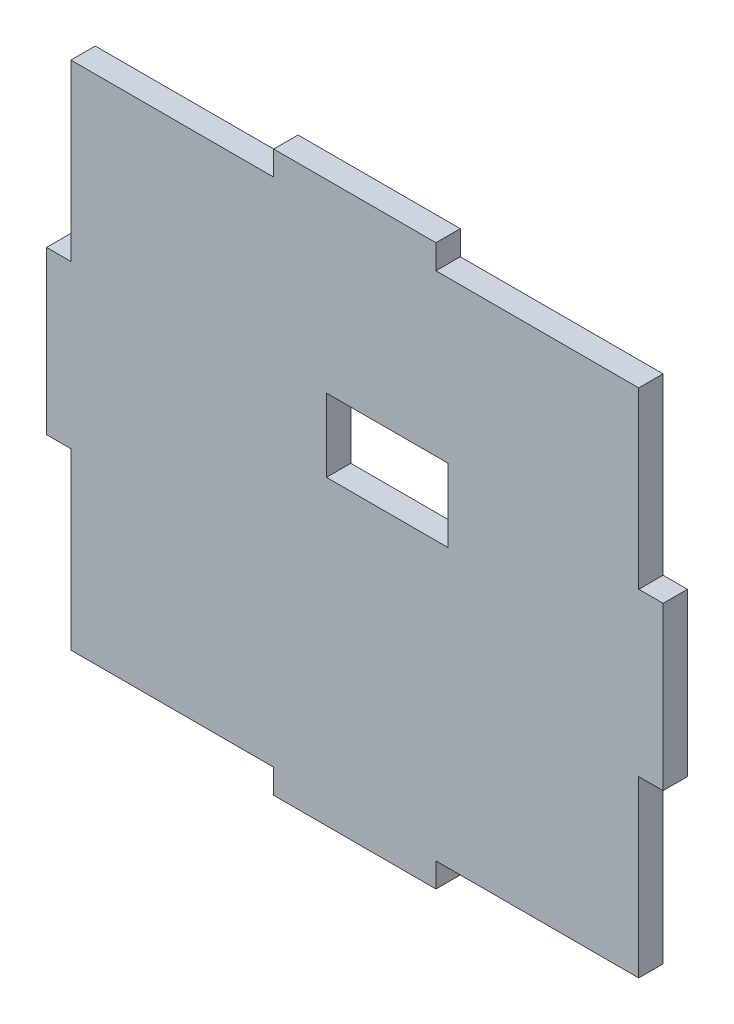
from build123d import *

# Parameters (mm, degrees)
SKETCH1_W           = 70
SKETCH1_H           = 63
BOSS_EXTRUDE1_DEPTH = 3
SKETCH2_W           = 15
SKETCH2_H           = 9
CUT_EXTRUDE1_DEPTH  = 3
SKETCH4_W           = 3
SKETCH4_H           = 20
SKETCH4_W_2         = 20
SKETCH4_H_2         = 3
BOSS_EXTRUDE2_DEPTH = 3


with BuildPart() as part:
    # Sketch1 → Boss-Extrude1 (new body)
    with BuildSketch(Plane.XY):
        Rectangle(SKETCH1_W, SKETCH1_H)
    extrude(amount=BOSS_EXTRUDE1_DEPTH)

    # Sketch2 → Cut-Extrude1 (cut)
    with BuildSketch(Plane.XY.offset(3)):
        with Locations((4, 7.2)):
            Rectangle(SKETCH2_W, SKETCH2_H)
    extrude(amount=-CUT_EXTRUDE1_DEPTH, mode=Mode.SUBTRACT)

    # Sketch4 → Boss-Extrude2 (add)
    with BuildSketch(Plane.XY.offset(3)):
        with Locations((36.5, 0)):
            Rectangle(SKETCH4_W, SKETCH4_H)
        with Locations((-36.5, 0)):
            Rectangle(SKETCH4_W, SKETCH4_H)
        with Locations((0, 33)):
            Rectangle(SKETCH4_W_2, SKETCH4_H_2)
        with Locations((0, -33)):
            Rectangle(SKETCH4_W_2, SKETCH4_H_2)
    extrude(amount=-BOSS_EXTRUDE2_DEPTH)


solid = part.part
